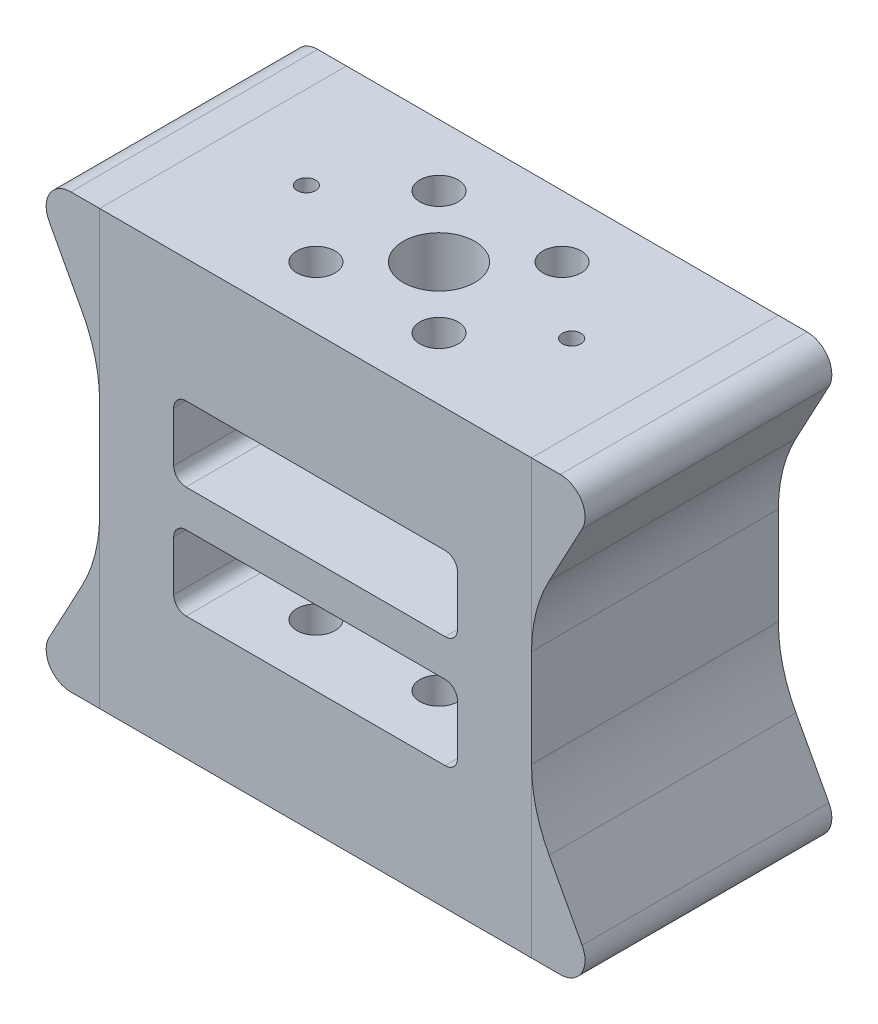
from build123d import *

# Parameters (mm, degrees)
SKETCH1_W             = 35
SKETCH1_H             = 35.1
BOSS_EXTRUDE1_DEPTH   = 16
CUT_EXTRUDE1_REACH    = 83.623
SKETCH6_W             = 37.150203726
SKETCH6_H             = 36.965069821
CUT_EXTRUDE2_DEPTH    = 81.661734542
SKETCH7_R             = 2.9
SKETCH7_R_2           = 1.55
CUT_EXTRUDE3_DEPTH    = 12
BOSS_EXTRUDE2_DEPTH   = 20
BOSS_EXTRUDE2_2_DEPTH = 20
BOSS_EXTRUDE2_3_DEPTH = 20
BOSS_EXTRUDE2_4_DEPTH = 20
SKETCH11_R            = 0.75
CUT_EXTRUDE4_DEPTH    = 10
SKETCH12_R            = 1.55
CUT_EXTRUDE5_DEPTH    = 10
SKETCH14_R            = 3
CUT_EXTRUDE7_DEPTH    = 6


with BuildPart() as part:
    # Sketch1 → Boss-Extrude1 (new body)
    with BuildSketch(Plane.XY):
        with Locations((1.938408795, -60.093181818)):
            Rectangle(SKETCH1_W, SKETCH1_H)
    extrude(amount=BOSS_EXTRUDE1_DEPTH)

    # Sketch2 → Cut-Extrude1 (cut, up to next)
    with BuildSketch(Plane.XY.offset(16), mode=Mode.PRIVATE) as cut_extrude1_sk1:
        with BuildLine():
            Line((-9.561591205, -53.543181818), (-9.561591205, -57.593181818))
            ThreePointArc((-9.561591205, -57.593181818), (-9.268697986, -58.300288599), (-8.561591205, -58.593181818))
            Line((-8.561591205, -58.593181818), (12.438408795, -58.593181818))
            ThreePointArc((12.438408795, -58.593181818), (13.145515577, -58.300288599), (13.438408795, -57.593181818))
            Line((13.438408795, -57.593181818), (13.438408795, -53.543181818))
            ThreePointArc((13.438408795, -53.543181818), (13.145515577, -52.836075037), (12.438408795, -52.543181818))
            Line((12.438408795, -52.543181818), (-8.561591205, -52.543181818))
            ThreePointArc((-8.561591205, -52.543181818), (-9.268697986, -52.836075037), (-9.561591205, -53.543181818))
        make_face()
    cut_extrude1_tool1 = extrude(cut_extrude1_sk1.sketch, amount=-CUT_EXTRUDE1_REACH, mode=Mode.PRIVATE) & part.part
    # Sketch2 → Cut-Extrude1 (cut, up to next)
    with BuildSketch(Plane.XY.offset(16), mode=Mode.PRIVATE) as cut_extrude1_sk2:
        with BuildLine():
            Line((-9.561591205, -62.593181818), (-9.561591205, -66.643181818))
            ThreePointArc((-9.561591205, -66.643181818), (-9.268697986, -67.350288599), (-8.561591205, -67.643181818))
            Line((-8.561591205, -67.643181818), (12.438408795, -67.643181818))
            ThreePointArc((12.438408795, -67.643181818), (13.145515577, -67.350288599), (13.438408795, -66.643181818))
            Line((13.438408795, -66.643181818), (13.438408795, -62.593181818))
            ThreePointArc((13.438408795, -62.593181818), (13.145515577, -61.886075037), (12.438408795, -61.593181818))
            Line((12.438408795, -61.593181818), (-8.561591205, -61.593181818))
            ThreePointArc((-8.561591205, -61.593181818), (-9.268697986, -61.886075037), (-9.561591205, -62.593181818))
        make_face()
    cut_extrude1_tool2 = extrude(cut_extrude1_sk2.sketch, amount=-CUT_EXTRUDE1_REACH, mode=Mode.PRIVATE) & part.part
    add(cut_extrude1_tool1.solids().sort_by_distance((1.938409, -55.568182, 16))[0], mode=Mode.SUBTRACT)
    add(cut_extrude1_tool2.solids().sort_by_distance((1.938409, -64.618182, 16))[0], mode=Mode.SUBTRACT)

    # Sketch6 → Cut-Extrude2 (cut, through all)
    with BuildSketch(Plane.XY.offset(6)):
        with Locations((2.061831399, -60.247460073)):
            Rectangle(SKETCH6_W, SKETCH6_H)
    extrude(amount=-CUT_EXTRUDE2_DEPTH, mode=Mode.SUBTRACT)

    # Mirror3: part across plane


with BuildPart() as part_1:
    add(part.part)
    add(part.part.mirror(Plane.XY.offset(6)))

    # Sketch7 → Cut-Extrude3 (cut)
    with BuildSketch(Plane(origin=(0, -42.543181818, 0), x_dir=(1, 0, 0), z_dir=(0, 1, 0))):
        with Locations(Location((1.938408795, -6, 0), (0, 0, 270))):
            Circle(SKETCH7_R)
        with Locations(Location((-3.046694012, -1.014897193, 0), (0, 0, 270))):
            Circle(SKETCH7_R_2)
        with Locations(Location((6.923511603, -1.014897193, 0), (0, 0, 270))):
            Circle(SKETCH7_R_2)
        with Locations(Location((6.923511603, -10.985102807, 0), (0, 0, 270))):
            Circle(SKETCH7_R_2)
        with Locations(Location((-3.046694012, -10.985102807, 0), (0, 0, 270))):
            Circle(SKETCH7_R_2)
    cut_extrude3 = extrude(amount=-CUT_EXTRUDE3_DEPTH, mode=Mode.SUBTRACT)

    # Mirror4: Cut-Extrude3 across plane
    add(cut_extrude3.mirror(Plane.ZX.offset(-60.093181818)), mode=Mode.SUBTRACT)

    # Sketch11 → Cut-Extrude4 (cut)
    with BuildSketch(Plane(origin=(0, -42.543181818, 0), x_dir=(1, 0, 0), z_dir=(0, 1, 0))):
        with Locations(Location((12.688408795, -5.998165284, 0), (0, 0, 270))):
            Circle(SKETCH11_R)
        with Locations(Location((-8.811591205, -5.998165284, 0), (0, 0, 270))):
            Circle(SKETCH11_R)
    extrude(amount=-CUT_EXTRUDE4_DEPTH, mode=Mode.SUBTRACT)

    # Sketch12 → Cut-Extrude5 (cut)
    with BuildSketch(Plane.XZ.offset(77.643181818)):
        with Locations(Location((12.688408795, 6, 0), (0, 0, 270))):
            Circle(SKETCH12_R)
        with Locations(Location((-8.811591205, 6, 0), (0, 0, 270))):
            Circle(SKETCH12_R)
    extrude(amount=-CUT_EXTRUDE5_DEPTH, mode=Mode.SUBTRACT)

    # Sketch14 → Cut-Extrude7 (cut)
    with BuildSketch(Plane(origin=(0, -67.643181818, 0), x_dir=(-1, 0, 0), z_dir=(0, -1, 0))):
        with Locations((-12.688408795, -6)):
            Circle(SKETCH14_R)
        with Locations((8.811591205, -6)):
            Circle(SKETCH14_R)
    extrude(amount=-CUT_EXTRUDE7_DEPTH, mode=Mode.SUBTRACT)


with BuildPart() as body_2:
    # Sketch9 → Boss-Extrude2 (new body)
    with BuildSketch(Plane(origin=(0, 0, -4), x_dir=(-1, 0, 0), z_dir=(0, 0, -1))):
        with BuildLine():
            Line((-19.438408795, -56.13659522), (-19.438408795, -42.543181818))
            Line((-19.438408795, -42.543181818), (-21.771579944, -42.543181818))
            ThreePointArc((-21.771579944, -42.543181818), (-23.487901985, -43.516420576), (-23.533832896, -45.488943169))
            Line((-23.533832896, -45.488943169), (-20.864891082, -50.462027116))
            ThreePointArc((-20.864891082, -50.462027116), (-19.800492045, -53.211036518), (-19.438408795, -56.13659522))
        make_face()
    extrude(amount=-BOSS_EXTRUDE2_DEPTH)


with BuildPart() as body_3:
    # Sketch9 → Boss-Extrude2 2 (new body)
    with BuildSketch(Plane(origin=(0, 0, -4), x_dir=(-1, 0, 0), z_dir=(0, 0, -1))):
        with BuildLine():
            Line((-19.438408795, -77.643181818), (-19.438408795, -64.049768416))
            ThreePointArc((-19.438408795, -64.049768416), (-19.800492045, -66.975327119), (-20.864891082, -69.72433652))
            Line((-20.864891082, -69.72433652), (-23.533832896, -74.697420468))
            ThreePointArc((-23.533832896, -74.697420468), (-23.487901985, -76.669943061), (-21.771579944, -77.643181818))
            Line((-21.771579944, -77.643181818), (-19.438408795, -77.643181818))
        make_face()
    extrude(amount=-BOSS_EXTRUDE2_2_DEPTH)


with BuildPart() as body_4:
    # Sketch9 → Boss-Extrude2 3 (new body)
    with BuildSketch(Plane(origin=(0, 0, -4), x_dir=(-1, 0, 0), z_dir=(0, 0, -1))):
        with BuildLine():
            Line((15.561591205, -42.543181818), (15.561591205, -56.13659522))
            ThreePointArc((15.561591205, -56.13659522), (15.923674455, -53.211036518), (16.988073491, -50.462027116))
            Line((16.988073491, -50.462027116), (19.657015305, -45.488943169))
            ThreePointArc((19.657015305, -45.488943169), (19.611084395, -43.516420576), (17.894762353, -42.543181818))
            Line((17.894762353, -42.543181818), (15.561591205, -42.543181818))
        make_face()
    extrude(amount=-BOSS_EXTRUDE2_3_DEPTH)


with BuildPart() as body_5:
    # Sketch9 → Boss-Extrude2 4 (new body)
    with BuildSketch(Plane(origin=(0, 0, -4), x_dir=(-1, 0, 0), z_dir=(0, 0, -1))):
        with BuildLine():
            Line((15.561591205, -64.049768416), (15.561591205, -77.643181818))
            Line((15.561591205, -77.643181818), (17.894762353, -77.643181818))
            ThreePointArc((17.894762353, -77.643181818), (19.611084395, -76.669943061), (19.657015305, -74.697420468))
            Line((19.657015305, -74.697420468), (16.988073491, -69.72433652))
            ThreePointArc((16.988073491, -69.72433652), (15.923674455, -66.975327119), (15.561591205, -64.049768416))
        make_face()
    extrude(amount=-BOSS_EXTRUDE2_4_DEPTH)


solid = Compound([part_1.part, body_2.part, body_3.part, body_4.part, body_5.part])
